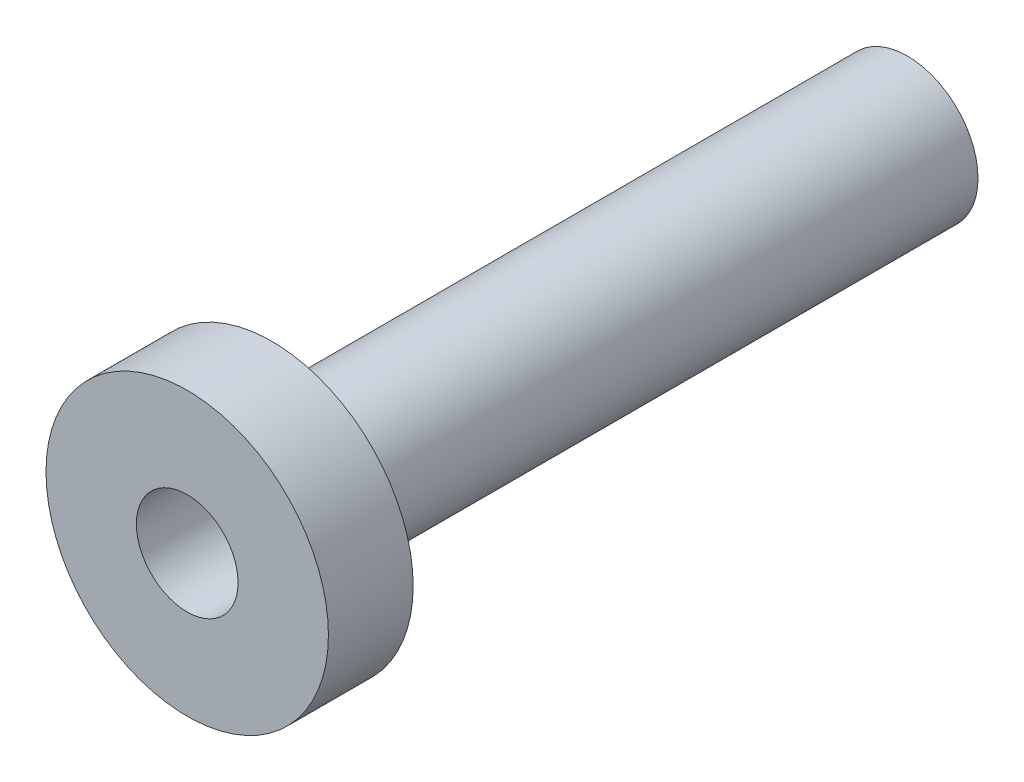
from build123d import *

# Parameters (mm, degrees)
CROQUIS1_R                 = 2.5
CROQUIS1_R_2               = 1.8
SALIENTE_EXTRUIR1_DEPTH    = 24
CROQUIS3_R                 = 1.8
SALIENTE_EXTRUIR2_DEPTH    = 3.15
CORTAR_EXTRUIR1_DEPTH      = 25.259018941
CORTAR_EXTRUIR1_DEPTH_BACK = 25.259018941
CROQUIS4_R                 = 1.265
CROQUIS5_R                 = 5
CROQUIS5_R_2               = 1.8
SALIENTE_EXTRUIR3_DEPTH    = 1.5


with BuildPart() as part:
    # Croquis1 → Saliente-Extruir1 (new body)
    with BuildSketch(Plane.XY):
        Circle(CROQUIS1_R)
        Circle(CROQUIS1_R_2, mode=Mode.SUBTRACT)
    extrude(amount=SALIENTE_EXTRUIR1_DEPTH)

    # Croquis3 → Saliente-Extruir2 (add)
    with BuildSketch(Plane(origin=(0, 0, 0), x_dir=(-1, 0, 0), z_dir=(0, 0, -1))):
        Circle(CROQUIS3_R)
    extrude(amount=-SALIENTE_EXTRUIR2_DEPTH)

    # Croquis4 → Cortar-Extruir1 (cut, two sides: drawn at the far end of the back side and taken through both)
    with BuildSketch(Plane(origin=(0, 0, 0), x_dir=(-1, 0, 0), z_dir=(0, 0, -1)).offset(-CORTAR_EXTRUIR1_DEPTH_BACK)):
        Circle(CROQUIS4_R)
    extrude(amount=CORTAR_EXTRUIR1_DEPTH + CORTAR_EXTRUIR1_DEPTH_BACK, mode=Mode.SUBTRACT)

    # Croquis5 → Saliente-Extruir3 (add, symmetric)
    with BuildSketch(Plane.XY.offset(24)):
        Circle(CROQUIS5_R)
        with Locations(Location((0, 0, 0), (0, 0, 180))):
            Circle(CROQUIS5_R_2, mode=Mode.SUBTRACT)
    extrude(amount=SALIENTE_EXTRUIR3_DEPTH, both=True)


solid = part.part
